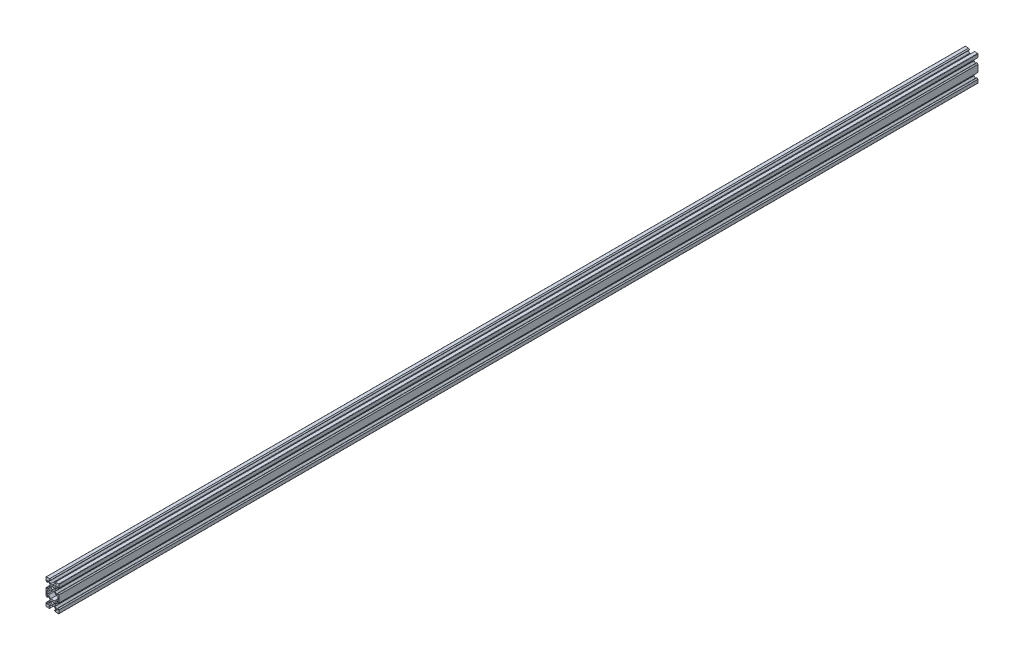
from build123d import *

# Parameters (mm, degrees)
SKETCH1_R           = 2.1
BOSS_EXTRUDE1_DEPTH = 1422.4


with BuildPart() as part:
    # Sketch1 → Boss-Extrude1 (new body)
    with BuildSketch(Plane.XY):
        with BuildLine():
            Line((4.58, -20), (9.5, -20))
            ThreePointArc((9.5, -20), (9.853553391, -19.853553391), (10, -19.5))
            Line((10, -19.5), (10, -14.58))
            Line((10, -14.58), (8.545, -13.125))
            Line((8.545, -13.125), (8.2, -13.125))
            Line((8.2, -13.125), (8.2, -15.5))
            Line((8.2, -15.5), (6.560660172, -15.5))
            Line((6.560660172, -15.5), (3.9, -12.839339828))
            Line((3.9, -12.839339828), (3.9, -10.21))
            Line((3.9, -10.21), (3.69, -10))
            Line((3.69, -10), (3.9, -9.79))
            Line((3.9, -9.79), (3.9, -7.160660172))
            Line((3.9, -7.160660172), (6.560660172, -4.5))
            Line((6.560660172, -4.5), (8.2, -4.5))
            Line((8.2, -4.5), (8.2, -6.875))
            Line((8.2, -6.875), (8.545, -6.875))
            Line((8.545, -6.875), (10, -5.42))
            Line((10, -5.42), (10, 5.42))
            Line((10, 5.42), (8.545, 6.875))
            Line((8.545, 6.875), (8.2, 6.875))
            Line((8.2, 6.875), (8.2, 4.5))
            Line((8.2, 4.5), (6.560660172, 4.5))
            Line((6.560660172, 4.5), (3.9, 7.160660172))
            Line((3.9, 7.160660172), (3.9, 9.79))
            Line((3.9, 9.79), (3.69, 10))
            Line((3.69, 10), (3.9, 10.21))
            Line((3.9, 10.21), (3.9, 12.839339828))
            Line((3.9, 12.839339828), (6.560660172, 15.5))
            Line((6.560660172, 15.5), (8.2, 15.5))
            Line((8.2, 15.5), (8.2, 13.125))
            Line((8.2, 13.125), (8.545, 13.125))
            Line((8.545, 13.125), (10, 14.58))
            Line((10, 14.58), (10, 19.5))
            ThreePointArc((10, 19.5), (9.853553391, 19.853553391), (9.5, 20))
            Line((9.5, 20), (4.58, 20))
            Line((4.58, 20), (3.125, 18.545))
            Line((3.125, 18.545), (3.125, 18.2))
            Line((3.125, 18.2), (5.5, 18.2))
            Line((5.5, 18.2), (5.5, 16.560660172))
            Line((5.5, 16.560660172), (2.839339828, 13.9))
            Line((2.839339828, 13.9), (0.21, 13.9))
            Line((0.21, 13.9), (0, 13.69))
            Line((0, 13.69), (-0.21, 13.9))
            Line((-0.21, 13.9), (-2.839339828, 13.9))
            Line((-2.839339828, 13.9), (-5.5, 16.560660172))
            Line((-5.5, 16.560660172), (-5.5, 18.2))
            Line((-5.5, 18.2), (-3.125, 18.2))
            Line((-3.125, 18.2), (-3.125, 18.545))
            Line((-3.125, 18.545), (-4.58, 20))
            Line((-4.58, 20), (-9.5, 20))
            ThreePointArc((-9.5, 20), (-9.853553391, 19.853553391), (-10, 19.5))
            Line((-10, 19.5), (-10, 14.58))
            Line((-10, 14.58), (-8.545, 13.125))
            Line((-8.545, 13.125), (-8.2, 13.125))
            Line((-8.2, 13.125), (-8.2, 15.5))
            Line((-8.2, 15.5), (-6.560660172, 15.5))
            Line((-6.560660172, 15.5), (-3.9, 12.839339828))
            Line((-3.9, 12.839339828), (-3.9, 10.21))
            Line((-3.9, 10.21), (-3.69, 10))
            Line((-3.69, 10), (-3.9, 9.79))
            Line((-3.9, 9.79), (-3.9, 7.160660172))
            Line((-3.9, 7.160660172), (-6.560660172, 4.5))
            Line((-6.560660172, 4.5), (-8.2, 4.5))
            Line((-8.2, 4.5), (-8.2, 6.875))
            Line((-8.2, 6.875), (-8.545, 6.875))
            Line((-8.545, 6.875), (-10, 5.42))
            Line((-10, 5.42), (-10, -5.42))
            Line((-10, -5.42), (-8.545, -6.875))
            Line((-8.545, -6.875), (-8.2, -6.875))
            Line((-8.2, -6.875), (-8.2, -4.5))
            Line((-8.2, -4.5), (-6.560660172, -4.5))
            Line((-6.560660172, -4.5), (-3.9, -7.160660172))
            Line((-3.9, -7.160660172), (-3.9, -9.79))
            Line((-3.9, -9.79), (-3.69, -10))
            Line((-3.69, -10), (-3.9, -10.21))
            Line((-3.9, -10.21), (-3.9, -12.839339828))
            Line((-3.9, -12.839339828), (-6.560660172, -15.5))
            Line((-6.560660172, -15.5), (-8.2, -15.5))
            Line((-8.2, -15.5), (-8.2, -13.125))
            Line((-8.2, -13.125), (-8.545, -13.125))
            Line((-8.545, -13.125), (-10, -14.58))
            Line((-10, -14.58), (-10, -19.5))
            ThreePointArc((-10, -19.5), (-9.853553391, -19.853553391), (-9.5, -20))
            Line((-9.5, -20), (-4.58, -20))
            Line((-4.58, -20), (-3.125, -18.545))
            Line((-3.125, -18.545), (-3.125, -18.2))
            Line((-3.125, -18.2), (-5.5, -18.2))
            Line((-5.5, -18.2), (-5.5, -16.560660172))
            Line((-5.5, -16.560660172), (-2.839339828, -13.9))
            Line((-2.839339828, -13.9), (-0.21, -13.9))
            Line((-0.21, -13.9), (0, -13.69))
            Line((0, -13.69), (0.21, -13.9))
            Line((0.21, -13.9), (2.839339828, -13.9))
            Line((2.839339828, -13.9), (5.5, -16.560660172))
            Line((5.5, -16.560660172), (5.5, -18.2))
            Line((5.5, -18.2), (3.125, -18.2))
            Line((3.125, -18.2), (3.125, -18.545))
            Line((3.125, -18.545), (4.58, -20))
        make_face()
        with Locations((0, -10)):
            Circle(SKETCH1_R, mode=Mode.SUBTRACT)
        Polygon((-6.239339828, -2.7), (-8.2, -2.7), (-8.2, 2.7), (-6.239339828, 2.7), (-2.839339828, 6.1), (2.839339828, 6.1), (6.239339828, 2.7), (8.2, 2.7), (8.2, -2.7), (6.239339828, -2.7), (2.839339828, -6.1), (-2.839339828, -6.1), align=None, mode=Mode.SUBTRACT)
        with Locations((0, 10)):
            Circle(SKETCH1_R, mode=Mode.SUBTRACT)
    extrude(amount=BOSS_EXTRUDE1_DEPTH)


solid = part.part
